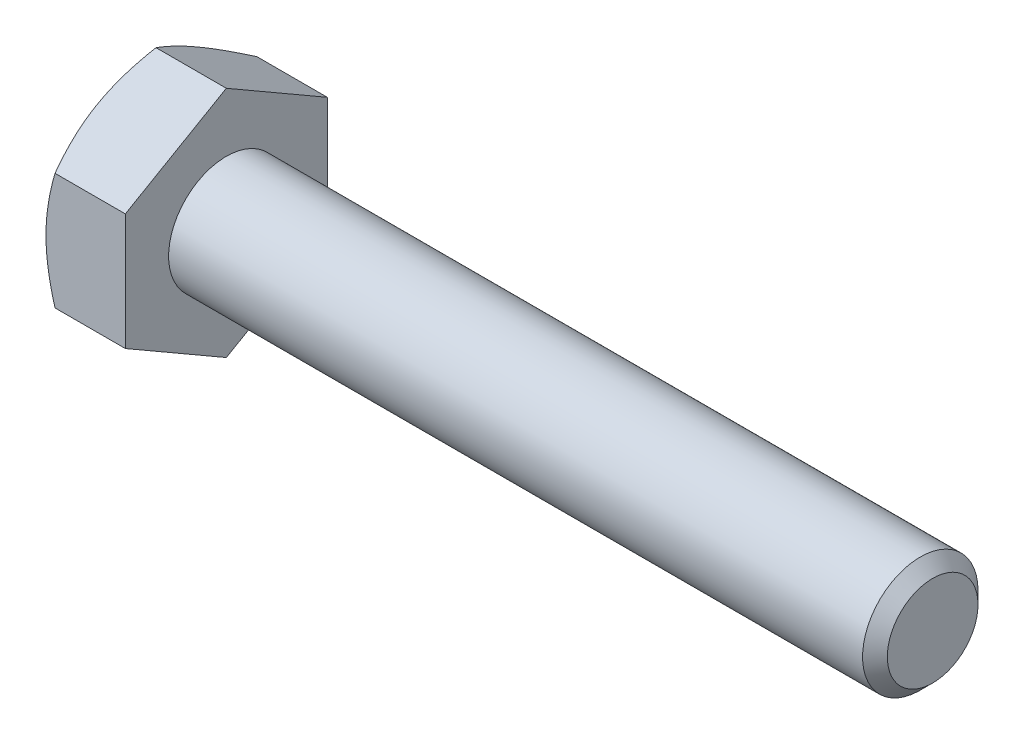
from build123d import *

# Parameters (mm, degrees)
SKETCH5_R           = 3.175
BOSS_EXTRUDE3_DEPTH = 38.862
CHAMFER1_SIZE       = 0.680357143
BOSS_EXTRUDE4_DEPTH = 4.365625
SKETCH8_OUTSIDE_W   = 178.468
SKETCH8_OUTSIDE_H   = 180.188
SKETCH8_OUTSIDE_R   = 5.55625
CUT_EXTRUDE3_DEPTH  = 45.05294575
CUT_EXTRUDE3_DRAFT  = -60


with BuildPart() as part:
    # Sketch5 → Boss-Extrude3 (new body)
    with BuildSketch(Plane(origin=(21.6138125, 0, 0), x_dir=(0, 0, -1), z_dir=(1, 0, 0))):
        Circle(SKETCH5_R)
    extrude(amount=-BOSS_EXTRUDE3_DEPTH)

    # Chamfer1
    chamfer1_edges = [part.edges().sort_by_distance(p)[0] for p in [
        (21.6138125, 0, 3.175),
    ]]
    chamfer(chamfer1_edges, length=CHAMFER1_SIZE)

    # Sketch6 → Boss-Extrude4 (add)
    with BuildSketch(Plane.ZY.offset(17.2481875)):
        Polygon((5.55625, 3.207902433), (0, 6.415804866), (-5.55625, 3.207902433), (-5.55625, -3.207902433), (0, -6.415804866), (5.55625, -3.207902433), align=None)
    extrude(amount=BOSS_EXTRUDE4_DEPTH)


with BuildPart() as cut_extrude3_tool:
    # Sketch8 outside → Cut-Extrude3 (with draft: the straight prism first)
    with BuildSketch(Plane.ZY.offset(21.6138125)):
        Rectangle(SKETCH8_OUTSIDE_W, SKETCH8_OUTSIDE_H)
        Circle(SKETCH8_OUTSIDE_R, mode=Mode.SUBTRACT)
    extrude(amount=-CUT_EXTRUDE3_DEPTH)
    # Cut-Extrude3: the draft: its side faces are tilted about the plane it starts from
    cut_extrude3_sides = [cut_extrude3_tool.faces().sort_by_distance(p)[0] for p in [
        (0.912660375, -90.094, 0),
        (0.912660375, 0, 89.234),
        (0.912660375, 90.094, 0),
        (0.912660375, 0, -89.234),
        (0.912660375, 0, -5.55625),
    ]]
    draft(cut_extrude3_sides, Plane.ZY.offset(21.6138125), CUT_EXTRUDE3_DRAFT)


with BuildPart() as part_1:
    add(part.part)

    # Cut-Extrude3: cut by cut_extrude3_tool
    add(cut_extrude3_tool.part, mode=Mode.SUBTRACT)


solid = part_1.part
